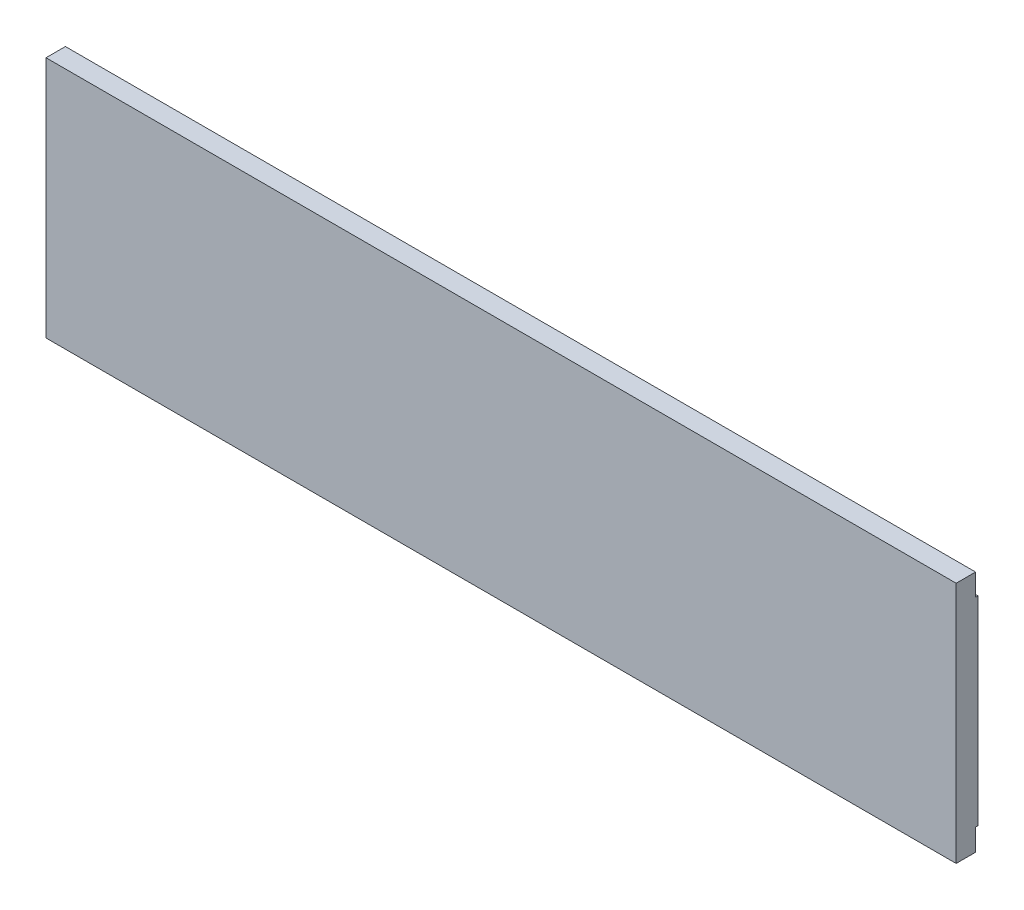
from build123d import *

# Parameters (mm, degrees)
SKETCH1_W           = 750
SKETCH1_H           = 200
BOSS_EXTRUDE1_DEPTH = 18
SKETCH2_W           = 2
SKETCH2_H           = 18
CUT_EXTRUDE3_DEPTH  = 757.851372464
SKETCH3_W           = 18
SKETCH3_H           = 328.758100902
SKETCH3_H_2         = 372.829020194
SKETCH3_H_3         = 369.502918338
SKETCH3_H_4         = 384.006512989
SKETCH3_H_5         = 390.144460662
CUT_EXTRUDE4_DEPTH  = 2


with BuildPart() as part:
    # Sketch1 → Boss-Extrude1 (new body)
    with BuildSketch(Plane.XY):
        Rectangle(SKETCH1_W, SKETCH1_H)
    extrude(amount=BOSS_EXTRUDE1_DEPTH)

    # Sketch2 → Cut-Extrude3 (cut, through all)
    with BuildSketch(Plane.ZY.offset(375)):
        with Locations((1, -91)):
            Rectangle(SKETCH2_W, SKETCH2_H)
        with Locations((1, 91)):
            Rectangle(SKETCH2_W, SKETCH2_H)
    extrude(amount=-CUT_EXTRUDE3_DEPTH, mode=Mode.SUBTRACT)

    # Sketch3 → Cut-Extrude4 (cut)
    with BuildSketch(Plane(origin=(0, 0, 0), x_dir=(-1, 0, 0), z_dir=(0, 0, -1))):
        with Locations((276, 27.416436842)):
            Rectangle(SKETCH3_W, SKETCH3_H)
        with Locations((138, 25.675959121)):
            Rectangle(SKETCH3_W, SKETCH3_H_2)
        with Locations((0, 35.637467242)):
            Rectangle(SKETCH3_W, SKETCH3_H_3)
        with Locations((-138, 42.889264568)):
            Rectangle(SKETCH3_W, SKETCH3_H_4)
        with Locations((-276, 58.109616722)):
            Rectangle(SKETCH3_W, SKETCH3_H_5)
    extrude(amount=-CUT_EXTRUDE4_DEPTH, mode=Mode.SUBTRACT)


solid = part.part
